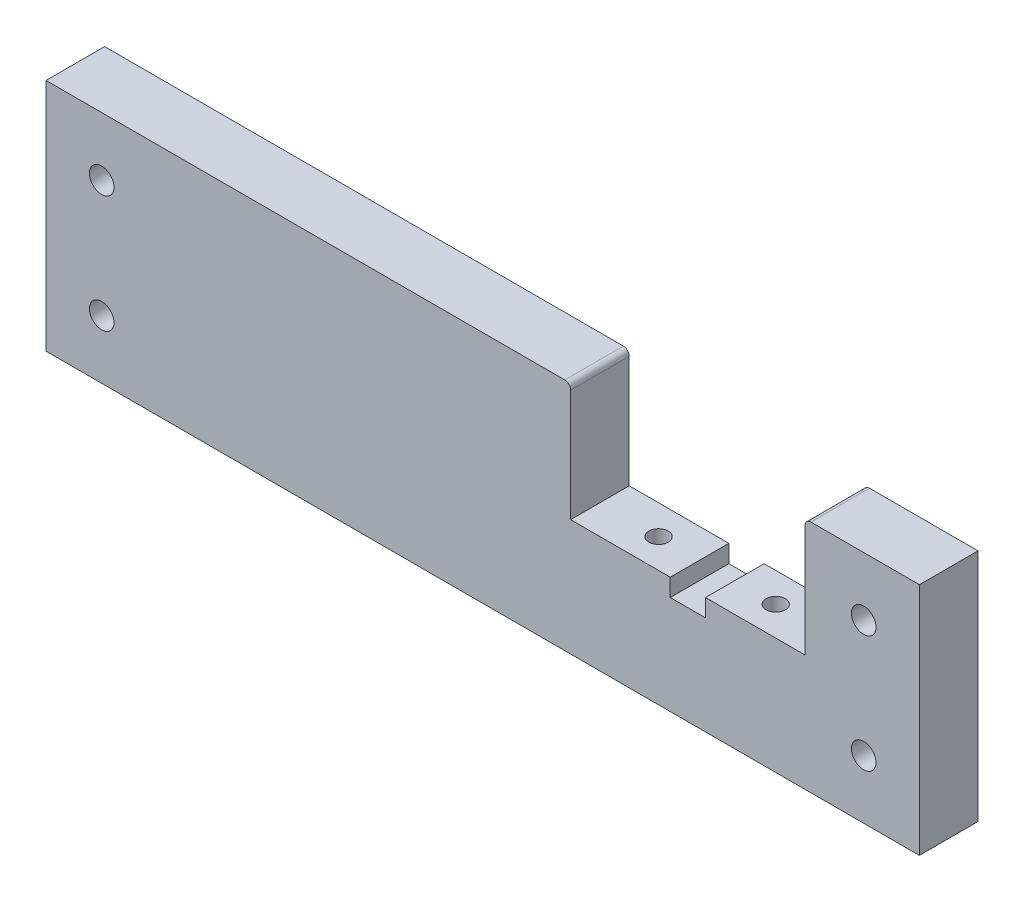
from build123d import *

# Parameters (mm, degrees)
BOSS_EXTRUDE1_DEPTH             = 10
TAP_DRILL_FOR_M4X0_7_TAP1_D     = 3.3
TAP_DRILL_FOR_M4X0_7_TAP1_DEPTH = 5
TAP_DRILL_FOR_M4X0_7_TAP1_TIP   = 0.991420021
TAP_DRILL_FOR_M5X0_8_TAP3_D     = 4.2
TAP_DRILL_FOR_M5X0_8_TAP2_D     = 4.2
TAP_DRILL_FOR_M5X0_8_TAP2_DEPTH = 7
TAP_DRILL_FOR_M5X0_8_TAP2_TIP   = 1.2618073
FILLET1_R                       = 1


with BuildPart() as part:
    # Sketch1 → Boss-Extrude1 (new body)
    with BuildSketch(Plane.XY):
        Polygon((15, 40), (-74.5, 40), (-74.5, 0), (74.5, 0), (74.5, 40), (55, 40), (55, 19.855), (38.005, 19.855), (38.005, 16.85), (31.995, 16.85), (31.995, 19.855), (15, 19.855), align=None)
    extrude(amount=-BOSS_EXTRUDE1_DEPTH)

    # Tap Drill for M4x0.7 Tap1
    with Locations(Plane(origin=(25, 19.855, -5), x_dir=(1, 0, 0), z_dir=(0, 1, 0))):
        with Locations((0, 0), (20, 0)):
            Hole(TAP_DRILL_FOR_M4X0_7_TAP1_D / 2, depth=TAP_DRILL_FOR_M4X0_7_TAP1_DEPTH)
            with Locations((0, 0, -(TAP_DRILL_FOR_M4X0_7_TAP1_DEPTH + TAP_DRILL_FOR_M4X0_7_TAP1_TIP / 2))):  # 118° drill point
                Cone(0, TAP_DRILL_FOR_M4X0_7_TAP1_D / 2, TAP_DRILL_FOR_M4X0_7_TAP1_TIP, mode=Mode.SUBTRACT)

    # Tap Drill for M5x0.8 Tap3 (through all)
    with Locations(Plane(origin=(-65, 30, 0), x_dir=(1, 0, 0), z_dir=(0, 0, 1))):
        with Locations((0, 0), (0, -20), (130, -20), (130, 0)):
            Hole(TAP_DRILL_FOR_M5X0_8_TAP3_D / 2)

    # Tap Drill for M5x0.8 Tap2
    with Locations(Plane(origin=(-60, 0, -5), x_dir=(-1, 0, 0), z_dir=(0, -1, 0))):
        with Locations((0, 0), (-60, 0), (-120, 0)):
            Hole(TAP_DRILL_FOR_M5X0_8_TAP2_D / 2, depth=TAP_DRILL_FOR_M5X0_8_TAP2_DEPTH)
            with Locations((0, 0, -(TAP_DRILL_FOR_M5X0_8_TAP2_DEPTH + TAP_DRILL_FOR_M5X0_8_TAP2_TIP / 2))):  # 118° drill point
                Cone(0, TAP_DRILL_FOR_M5X0_8_TAP2_D / 2, TAP_DRILL_FOR_M5X0_8_TAP2_TIP, mode=Mode.SUBTRACT)

    # Fillet1
    fillet1_edges = [part.edges().sort_by_distance(p)[0] for p in [
        (55, 40, -5),
        (15, 40, -5),
    ]]
    fillet(fillet1_edges, radius=FILLET1_R)


solid = part.part
